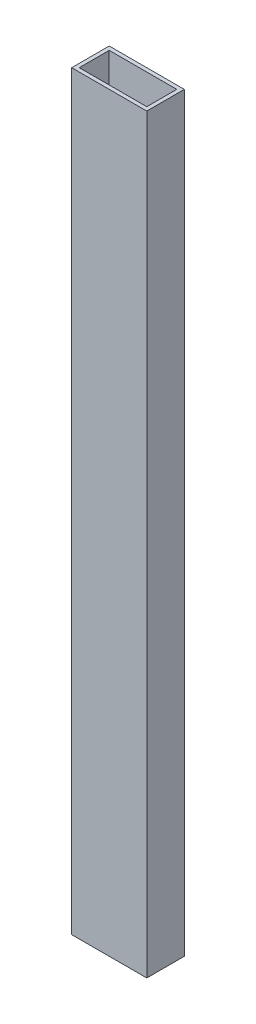
from build123d import *

# Parameters (mm, degrees)
ESBO_O1_W   = 40
ESBO_O1_H   = 20
ESBO_O1_W_2 = 36
ESBO_O1_H_2 = 16


with BuildPart() as part:
    # Varredura1: sweep along a path in Esboço2
    with BuildLine(Plane(origin=(0, 0, 0), x_dir=(0, 0, -1), z_dir=(1, 0, 0))) as varredura1_path:
        Line((0, 0), (0, -400))
    # Esboço1 → Varredura1 (sweep)
    with BuildSketch(Plane(origin=(0, 0, 0), x_dir=(1, 0, 0), z_dir=(0, 1, 0))):
        Rectangle(ESBO_O1_W, ESBO_O1_H)
        Rectangle(ESBO_O1_W_2, ESBO_O1_H_2, mode=Mode.SUBTRACT)
    sweep(path=varredura1_path.line)


solid = part.part
